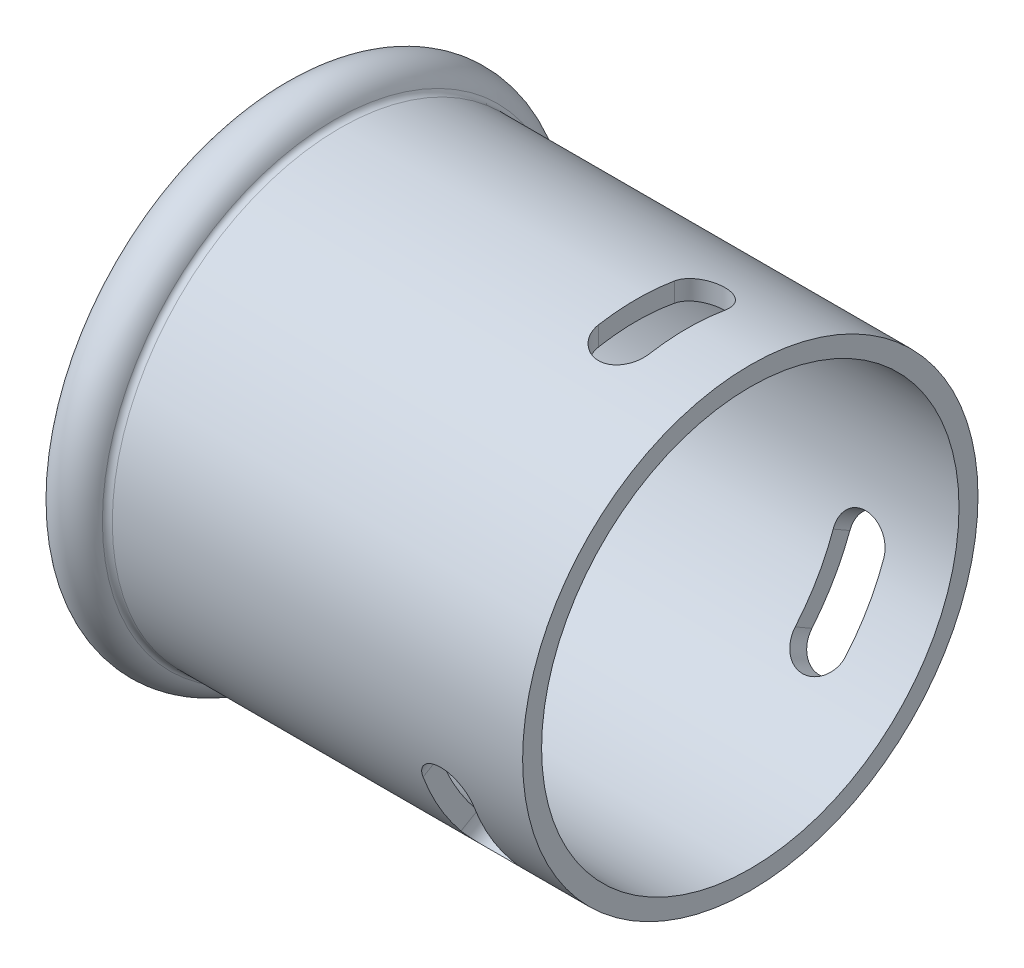
from build123d import *

# Parameters (mm, degrees)
ENL_V_MAT_EXTRU_1_DEPTH      = 20
R_P_TITION_CIRCULAIRE1_COUNT = 3


with BuildPart() as part:
    # Esquisse1 → Base-Révolution (revolve)
    with BuildSketch(Plane.XY, mode=Mode.PRIVATE) as base_r_volution_sk:
        with BuildLine():
            Line((6.945704467, 17.5), (6.945704467, 17))
            Line((6.945704467, 17), (5.445704467, 17))
            Line((5.445704467, 17), (5.445704467, 17.5))
            ThreePointArc((5.445704467, 17.5), (7.279427039, 19.711156508), (9.791671669, 18.318181818))
            ThreePointArc((9.791671669, 18.318181818), (9.975404121, 18.087138588), (10.257442159, 18))
            Line((10.257442159, 18), (42.695704467, 18))
            Line((42.695704467, 18), (42.695704467, 16.5))
            Line((42.695704467, 16.5), (8.841348391, 16.5))
            ThreePointArc((8.841348391, 16.5), (8.423018378, 16.726138721), (8.383090822, 17.2))
            ThreePointArc((8.383090822, 17.2), (7.8489367, 18.234179735), (6.945704467, 17.5))
        make_face()
    revolve(base_r_volution_sk.sketch.rotate(Axis((10.659710849, 0, 0), (1, 0, 0)), 90), axis=Axis((10.659710849, 0, 0), (1, 0, 0)))

    # Esquisse2 → Enlèv. mat.-Extru.1 (cut)
    with BuildSketch(Plane(origin=(0, 0, 0), x_dir=(1, 0, 0), z_dir=(0, 1, 0))):
        with BuildLine():
            Line((33.695704467, -3), (33.695704467, 3))
            ThreePointArc((33.695704467, 3), (35.695704467, 5), (37.695704467, 3))
            Line((37.695704467, 3), (37.695704467, -3))
            ThreePointArc((37.695704467, -3), (35.695704467, -5), (33.695704467, -3))
        make_face()
    enl_v_mat_extru_1 = extrude(amount=ENL_V_MAT_EXTRU_1_DEPTH, mode=Mode.SUBTRACT)

    # Répétition circulaire1: Enlèv. mat.-Extru.1 ×3 about axis
    r_p_tition_circulaire1_axis = Axis((10.659710849, 0, 0), (1, 0, 0))
    for i in range(1, R_P_TITION_CIRCULAIRE1_COUNT):
        add(enl_v_mat_extru_1.rotate(r_p_tition_circulaire1_axis, i * 360 / R_P_TITION_CIRCULAIRE1_COUNT), mode=Mode.SUBTRACT)


solid = part.part
